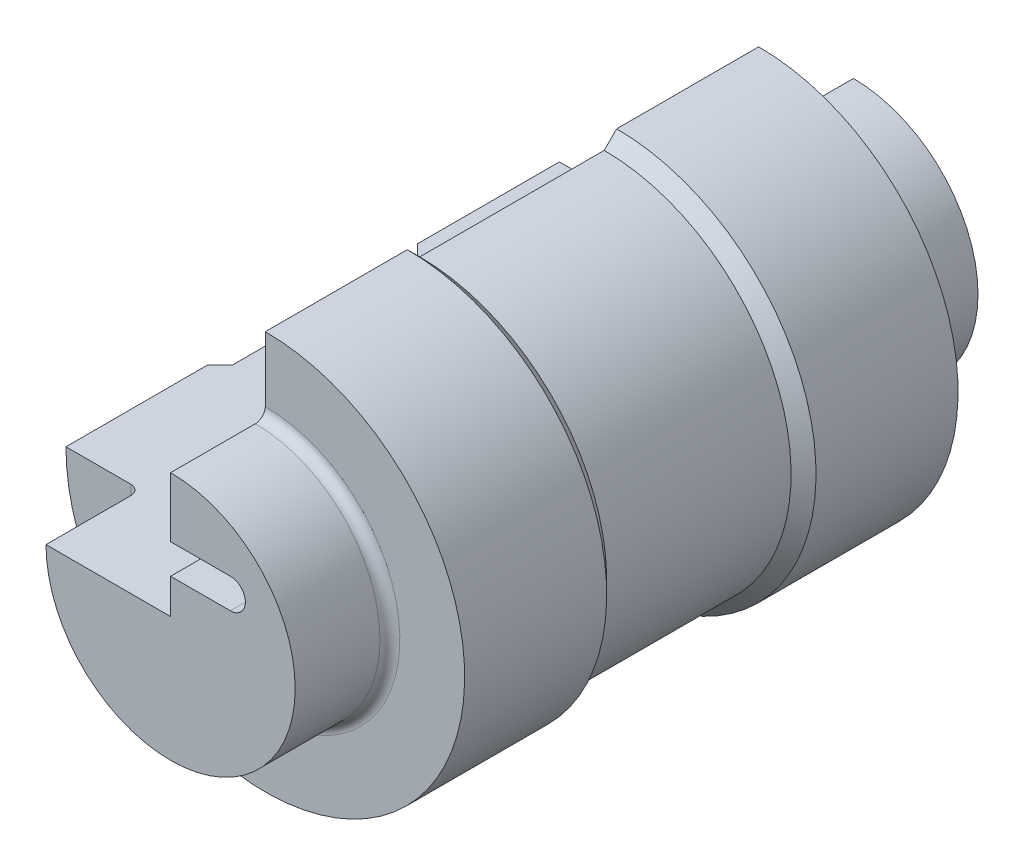
from build123d import *

# Parameters (mm, degrees)
ENL_V_MAT_EXTRU_1_DEPTH      = 89.838336319
ENL_V_MAT_EXTRU_1_DEPTH_BACK = 89.838336319
ESQUISSE3_W                  = 49.590285902
ESQUISSE3_H                  = 55.327856271
ENL_V_MAT_EXTRU_2_DEPTH      = 89.838336319
ENL_V_MAT_EXTRU_2_DEPTH_BACK = 89.838336319


with BuildPart() as part:
    # Esquisse1 → Révolution1 (revolve)
    with BuildSketch(Plane(origin=(0, 0, 0), x_dir=(0, 0, -1), z_dir=(1, 0, 0)), mode=Mode.PRIVATE) as r_volution1_sk:
        with BuildLine():
            Line((-68.5, 0), (68.5, 0))
            Line((68.5, 0), (68.5, 25))
            Line((68.5, 25), (51.5, 25))
            ThreePointArc((51.5, 25), (50.085786438, 25.585786438), (49.5, 27))
            Line((49.5, 27), (49.5, 40))
            Line((49.5, 40), (21, 40))
            Line((21, 40), (18.5, 37.5))
            Line((18.5, 37.5), (-18.5, 37.5))
            Line((-18.5, 37.5), (-21, 40))
            Line((-21, 40), (-49.5, 40))
            Line((-49.5, 40), (-49.5, 27))
            ThreePointArc((-49.5, 27), (-50.085786438, 25.585786438), (-51.5, 25))
            Line((-51.5, 25), (-68.5, 25))
            Line((-68.5, 25), (-68.5, 0))
        make_face()
    revolve(r_volution1_sk.sketch.rotate(Axis((0, 0, 68.5), (0, 0, -1)), 90), axis=Axis((0, 0, 68.5), (0, 0, -1)))

    # Esquisse3 → Enlèv. mat.-Extru.1 (cut, two sides: drawn at the far end of the back side and taken through both)
    with BuildSketch(Plane.XY.offset(-ENL_V_MAT_EXTRU_1_DEPTH_BACK)):
        with Locations((-24.795142951, 27.663928136)):
            Rectangle(ESQUISSE3_W, ESQUISSE3_H)
    extrude(amount=ENL_V_MAT_EXTRU_1_DEPTH + ENL_V_MAT_EXTRU_1_DEPTH_BACK, mode=Mode.SUBTRACT)

    # Esquisse4 → Enlèv. mat.-Extru.2 (cut, two sides: drawn at the far end of the back side and taken through both)
    with BuildSketch(Plane.XY.offset(-ENL_V_MAT_EXTRU_2_DEPTH_BACK)):
        with BuildLine():
            Line((0, 7), (12, 7))
            ThreePointArc((12, 7), (15, 10), (12, 13))
            Line((12, 13), (0, 13))
            Line((0, 13), (0, 7))
        make_face()
    extrude(amount=ENL_V_MAT_EXTRU_2_DEPTH + ENL_V_MAT_EXTRU_2_DEPTH_BACK, mode=Mode.SUBTRACT)


solid = part.part
